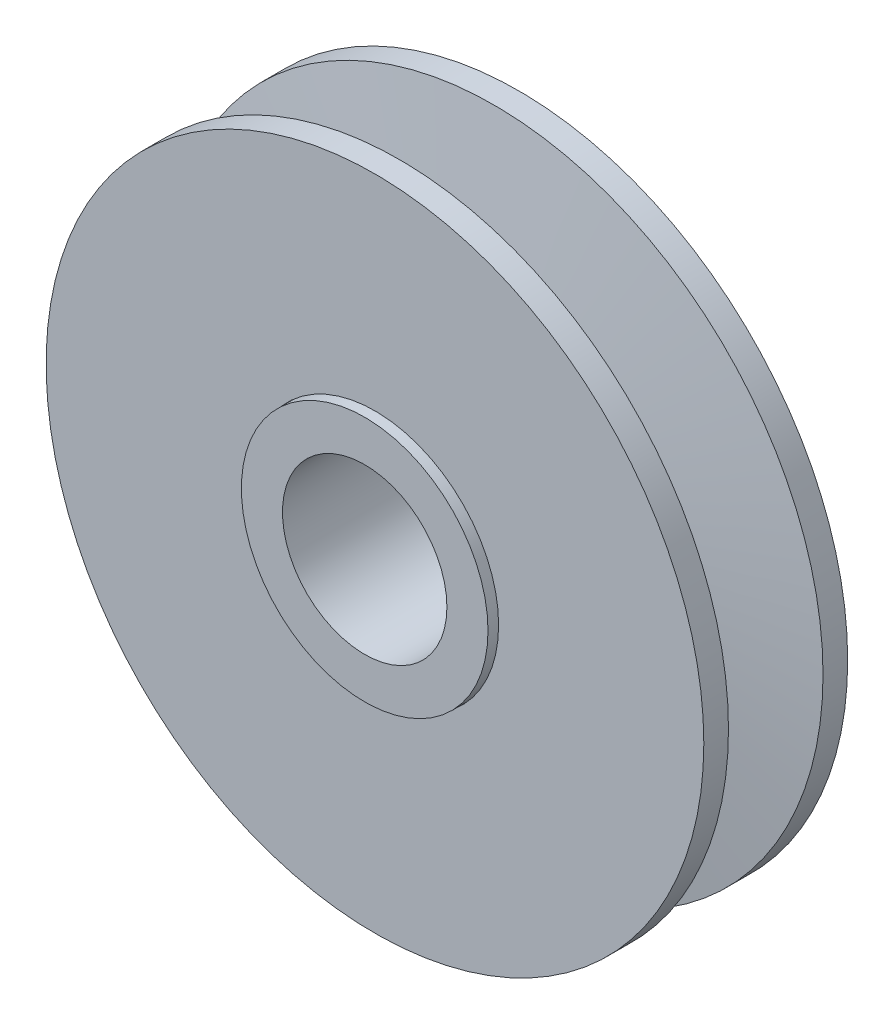
from build123d import *

# Parameters (mm, degrees)
CUT_EXTRUDE_THIN1_DEPTH      = 37.477972806
CUT_EXTRUDE_THIN1_DEPTH_BACK = 37.477972806
SKETCH2_R                    = 9.5504
SKETCH2_R_2                  = 9.525


with BuildPart() as part:
    # Sketch1 → Revolve1 (revolve)
    with BuildSketch(Plane(origin=(0, 0, 0), x_dir=(0, 0, -1), z_dir=(1, 0, 0)), mode=Mode.PRIVATE) as revolve1_sk:
        with BuildLine():
            Line((3.65125, 25.4), (5.55625, 25.4))
            Line((5.55625, 25.4), (5.55625, 9.525))
            Line((5.55625, 9.525), (6.35, 9.525))
            Line((6.35, 9.525), (6.35, 6.35))
            Line((6.35, 6.35), (-6.35, 6.35))
            Line((-6.35, 6.35), (-6.35, 9.525))
            Line((-6.35, 9.525), (-5.55625, 9.525))
            Line((-5.55625, 9.525), (-5.55625, 25.4))
            Line((-5.55625, 25.4), (-3.65125, 25.4))
            Line((-3.65125, 25.4), (-2.363899009, 14.794312658))
            ThreePointArc((-2.363899009, 14.794312658), (0, 12.7), (2.363899009, 14.794312658))
            Line((2.363899009, 14.794312658), (3.65125, 25.4))
        make_face()
    revolve(revolve1_sk.sketch.rotate(Axis((0, 0, 6.35), (0, 0, -1)), 90), axis=Axis((0, 0, 6.35), (0, 0, -1)))

    # Sketch2 → Cut-Extrude-Thin1 (cut, two sides: drawn at the far end of the back side and taken through both)
    with BuildSketch(Plane.XY.offset(-CUT_EXTRUDE_THIN1_DEPTH_BACK)):
        Circle(SKETCH2_R)
        Circle(SKETCH2_R_2, mode=Mode.SUBTRACT)
    extrude(amount=CUT_EXTRUDE_THIN1_DEPTH + CUT_EXTRUDE_THIN1_DEPTH_BACK, mode=Mode.SUBTRACT)


with BuildPart() as cut_extrude_thin1_piece_1:
    # of the separate pieces the step leaves, piece 1, a body of its own (cut_extrude_thin1_pieces)
    add(part.part.solids().sort_by_distance((25.4, 0, -3.65125))[0])


with BuildPart() as cut_extrude_thin1_piece_2:
    # of the separate pieces the step leaves, piece 2, a body of its own (cut_extrude_thin1_pieces)
    add(part.part.solids().sort_by_distance((9.525, 0, -5.55625))[0])


solid = Compound([cut_extrude_thin1_piece_1.part, cut_extrude_thin1_piece_2.part])
